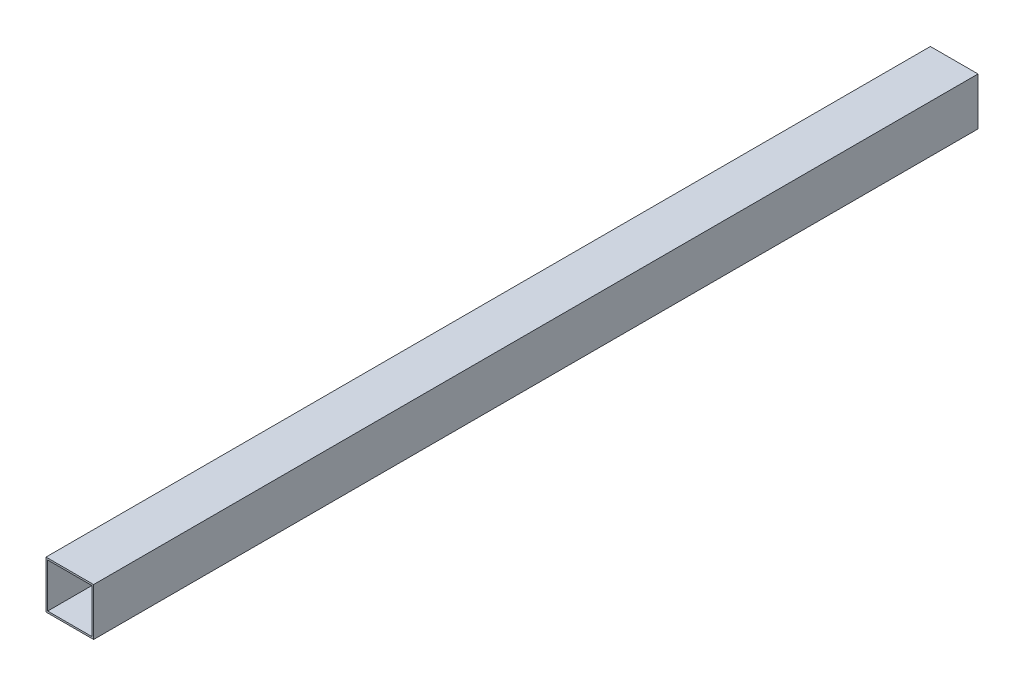
from build123d import *

# Parameters (mm, degrees)
CROQUIS2_W              = 70
CROQUIS2_H              = 70
CROQUIS2_W_2            = 65
CROQUIS2_H_2            = 65
SALIENTE_EXTRUIR1_DEPTH = 650


with BuildPart() as part:
    # Croquis2 → Saliente-Extruir1 (new, symmetric)
    with BuildSketch(Plane.XY):
        Rectangle(CROQUIS2_W, CROQUIS2_H)
        Rectangle(CROQUIS2_W_2, CROQUIS2_H_2, mode=Mode.SUBTRACT)
    extrude(amount=SALIENTE_EXTRUIR1_DEPTH, both=True)


solid = part.part
